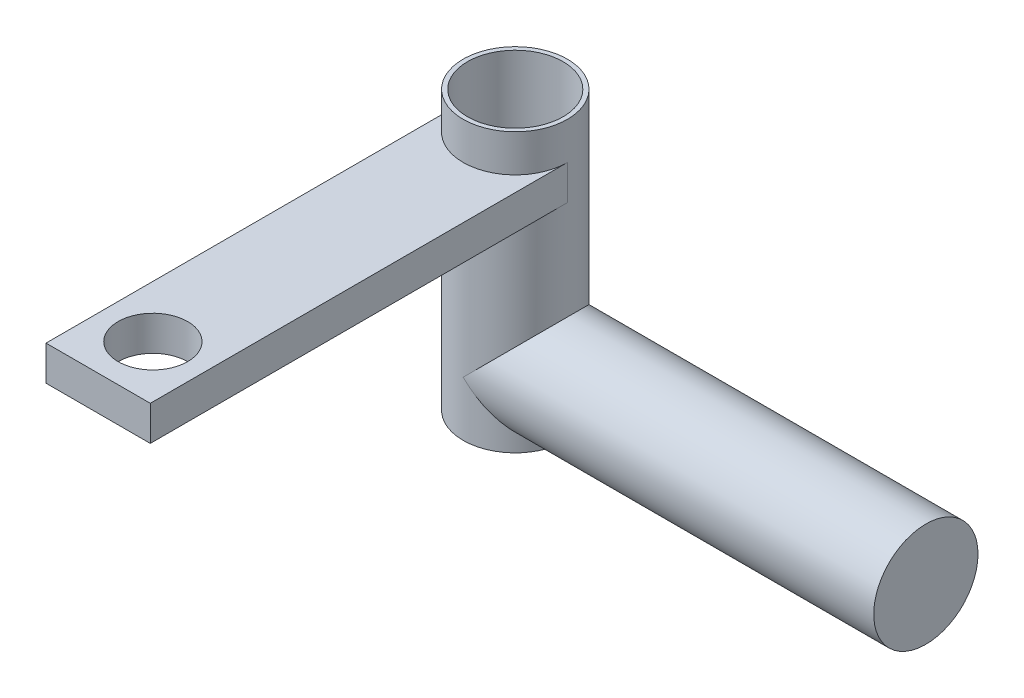
from build123d import *

# Parameters (mm, degrees)
SKETCH1_R          = 9.525
SLEEVE_DEPTH       = 50.8
SKETCH2_W          = 19.05
SKETCH2_H          = 6.35
BRACKET_DEPTH      = 76.2
SKETCH4_R          = 6.35
BRACKET_HOLE_DEPTH = 93.075
SKETCH5_R          = 9.525
SHAFT_DEPTH        = 75
SKETCH6_R          = 8.73125
SLEEVE_HOLE_DEPTH  = 119.372631972


with BuildPart() as part:
    # Sketch1 → Sleeve (new body)
    with BuildSketch(Plane(origin=(0, 0, 0), x_dir=(1, 0, 0), z_dir=(0, 1, 0))):
        with Locations(Location((0, 0, 0), (0, 0, 270))):
            Circle(SKETCH1_R)
    extrude(amount=SLEEVE_DEPTH)

    # Sketch2 → Bracket (add)
    with BuildSketch(Plane.XY):
        with Locations((0, 40.8)):
            Rectangle(SKETCH2_W, SKETCH2_H)
    extrude(amount=BRACKET_DEPTH)

    # Sketch4 → Bracket Hole (cut, through all)
    with BuildSketch(Plane(origin=(0, 0, 0), x_dir=(1, 0, 0), z_dir=(0, 1, 0))):
        with Locations(Location((0, -66.2, 0), (0, 0, 90))):
            Circle(SKETCH4_R)
    extrude(amount=BRACKET_HOLE_DEPTH, mode=Mode.SUBTRACT)

    # Sketch5 → Shaft (add)
    with BuildSketch(Plane(origin=(0, 0, 0), x_dir=(0, 0, -1), z_dir=(1, 0, 0))):
        with Locations((0, 10)):
            Circle(SKETCH5_R)
    extrude(amount=SHAFT_DEPTH)

    # Sketch6 → Sleeve Hole (cut, through all)
    with BuildSketch(Plane(origin=(0, 0, 0), x_dir=(1, 0, 0), z_dir=(0, 1, 0))):
        with Locations(Location((0, 0, 0), (0, 0, 270))):
            Circle(SKETCH6_R)
    extrude(amount=SLEEVE_HOLE_DEPTH, mode=Mode.SUBTRACT)


solid = part.part
